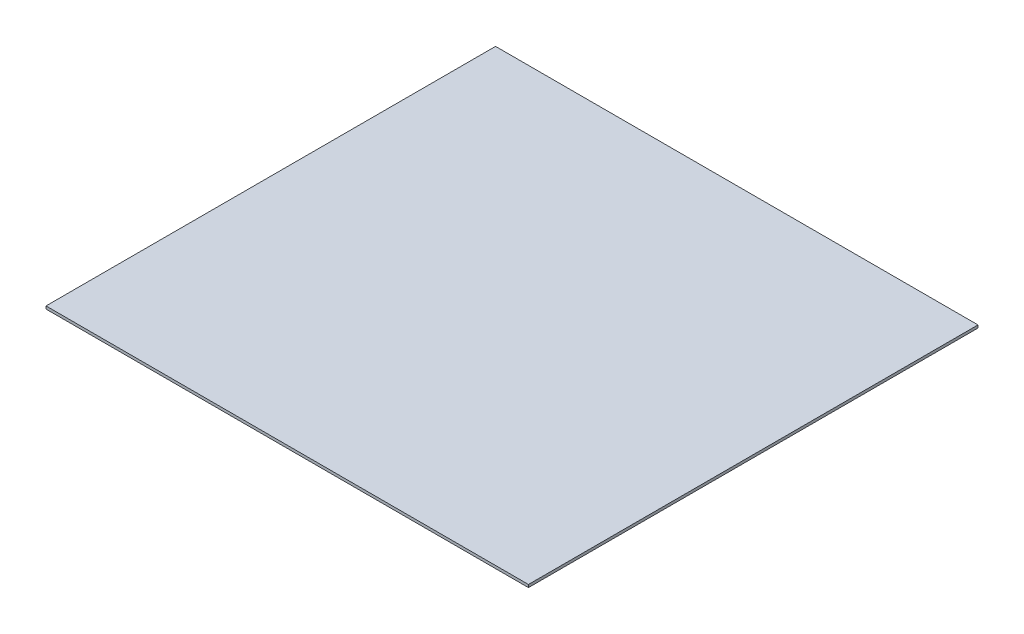
from build123d import *

# Parameters (mm, degrees)
SKETCH1_W           = 13411.2
SKETCH1_H           = 12496.8
BOSS_EXTRUDE1_DEPTH = 76.2


with BuildPart() as part:
    # Sketch1 → Boss-Extrude1 (new body)
    with BuildSketch(Plane(origin=(0, 0, 0), x_dir=(1, 0, 0), z_dir=(0, 1, 0))):
        with Locations((6705.6, 6248.4)):
            Rectangle(SKETCH1_W, SKETCH1_H)
    extrude(amount=BOSS_EXTRUDE1_DEPTH)


solid = part.part
